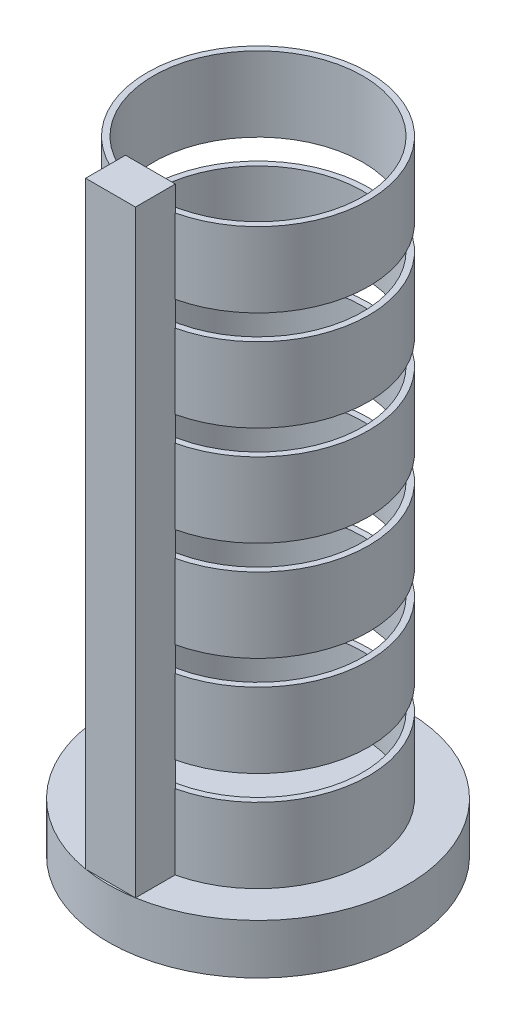
from build123d import *

# Parameters (mm, degrees)
SKETCH2_R           = 38.1
BOSS_EXTRUDE1_DEPTH = 12.7
SKETCH3_W           = 12.7
SKETCH3_H           = 10.16
BOSS_EXTRUDE2_DEPTH = 152.4
SKETCH4_R           = 28.194
SKETCH4_R_2         = 26.67
LPATTERN1_COUNT     = 6
LPATTERN1_PITCH     = 25.4


with BuildPart() as part:
    # Sketch2 → Boss-Extrude1 (new body)
    with BuildSketch(Plane(origin=(0, 0, 0), x_dir=(1, 0, 0), z_dir=(0, 1, 0))):
        with Locations(Location((0, 0, 0), (0, 0, 270))):
            Circle(SKETCH2_R)
    extrude(amount=BOSS_EXTRUDE1_DEPTH)

    # Sketch3 → Boss-Extrude2 (add)
    with BuildSketch(Plane(origin=(0, 12.7, 0), x_dir=(1, 0, 0), z_dir=(0, 1, 0))):
        with Locations((0, -32.487106623)):
            Rectangle(SKETCH3_W, SKETCH3_H)
    extrude(amount=BOSS_EXTRUDE2_DEPTH)

    # Sweep-Thin1: sweep along a path in Sketch5
    with BuildLine(Plane.XY) as sweep_thin1_path:
        Line((0, 12.7), (0, 31.75))
    # Sketch4 → Sweep-Thin1 (sweep)
    with BuildSketch(Plane(origin=(0, 12.7, 0), x_dir=(1, 0, 0), z_dir=(0, 1, 0))):
        Circle(SKETCH4_R)
        Circle(SKETCH4_R_2, mode=Mode.SUBTRACT)
    sweep_thin1 = sweep(path=sweep_thin1_path.line)

    # LPattern1: Sweep-Thin1 ×6
    with Locations(*[(0, i * LPATTERN1_PITCH, 0) for i in range(1, LPATTERN1_COUNT)]):
        add(sweep_thin1)


solid = part.part
